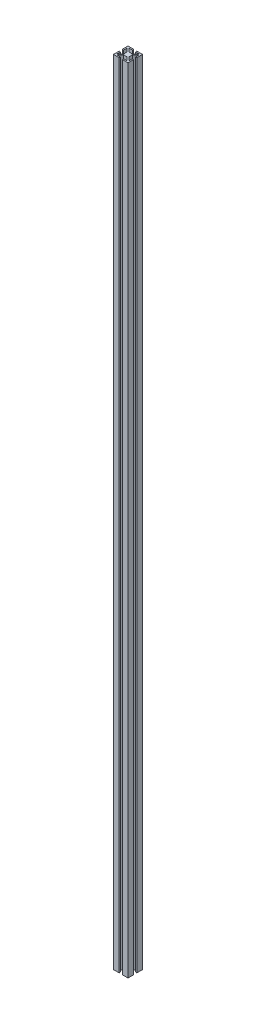
from build123d import *

# Parameters (mm, degrees)
BOSS_EXTRUDE1_DEPTH = 1384.3


with BuildPart() as part:
    # Sketch1 → Boss-Extrude1 (new body)
    with BuildSketch(Plane(origin=(11.365010382, 0, 9.846206226), x_dir=(1, 0, 0), z_dir=(0, 1, 0))):
        Polygon((-24.065010382, 22.546206226), (-14.229795365, 22.546206226), (-14.229795365, 20.336406226), (-20.292645817, 20.336406226), (-14.310945817, 14.354706226), (-8.419074947, 14.354706226), (-2.437374947, 20.336406226), (-8.5002254, 20.336406226), (-8.5002254, 22.546206226), (1.334989618, 22.546206226), (1.334989618, 12.710991208), (-0.874810382, 12.710991208), (-0.874810382, 18.773841661), (-6.856510382, 12.792141661), (-6.856510382, 6.900270791), (-0.874810382, 0.918570791), (-0.874810382, 6.981421243), (1.334989618, 6.981421243), (1.334989618, -2.853793774), (-8.5002254, -2.853793774), (-8.5002254, -0.643993774), (-2.437374947, -0.643993774), (-8.419074947, 5.337706226), (-14.310945817, 5.337706226), (-20.292645817, -0.643993774), (-14.229795365, -0.643993774), (-14.229795365, -2.853793774), (-24.065010382, -2.853793774), (-24.065010382, 6.981421243), (-21.855210382, 6.981421243), (-21.855210382, 0.918570791), (-15.873510382, 6.900270791), (-15.873510382, 12.792141661), (-21.855210382, 18.773841661), (-21.855210382, 12.710991208), (-24.065010382, 12.710991208), align=None)
    extrude(amount=BOSS_EXTRUDE1_DEPTH)


solid = part.part
